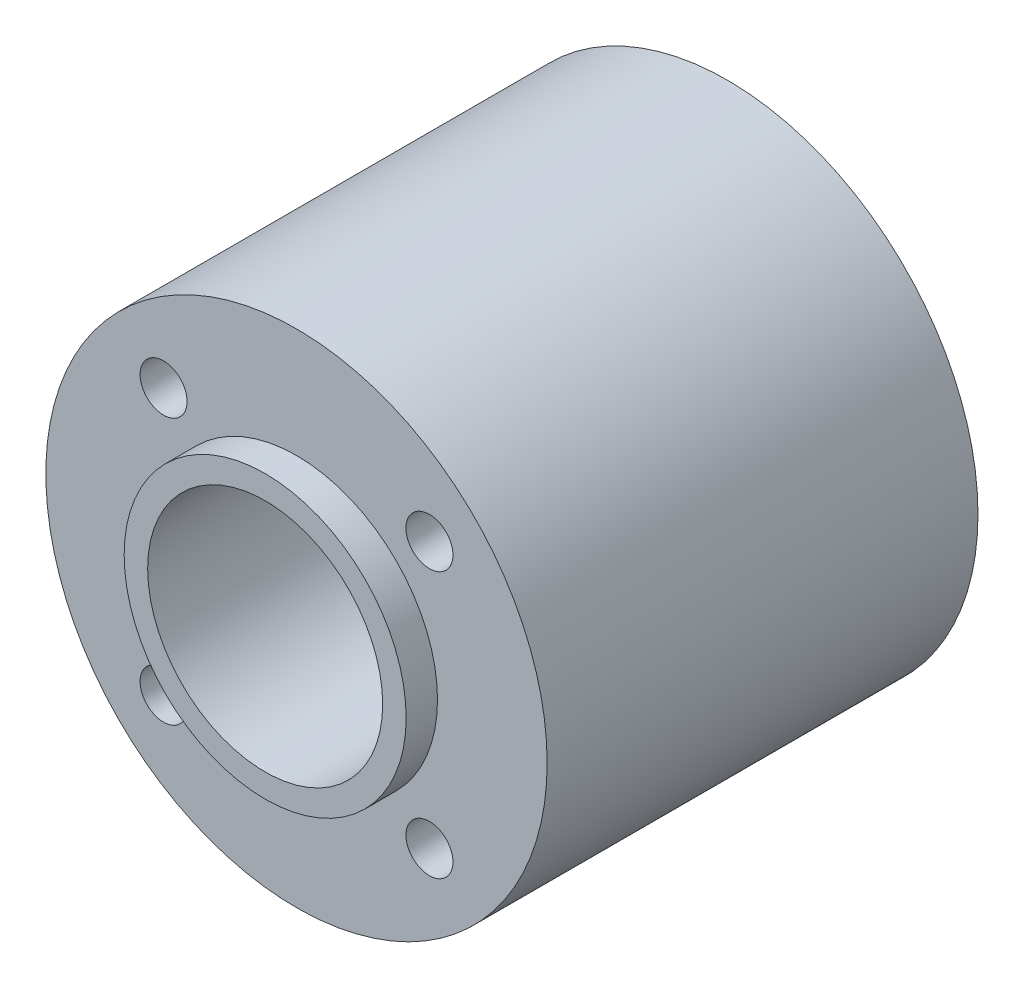
from build123d import *

# Parameters (mm, degrees)
SKETCH1_R           = 16
SKETCH1_R_2         = 1.5
SKETCH1_R_3         = 9
SKETCH1_R_4         = 7.5
BOSS_EXTRUDE1_DEPTH = 13.75
SKETCH2_R           = 1.5
CUT_EXTRUDE1_DEPTH  = 36.612497806
CIRPATTERN1_COUNT   = 4
SKETCH3_R           = 9
SKETCH3_R_2         = 7.5
BOSS_EXTRUDE2_DEPTH = 2


with BuildPart() as part:
    # Sketch1 → Boss-Extrude1 (new, symmetric)
    # profile 1 of 3: a face of its own
    with BuildSketch(Plane.XY):
        Circle(SKETCH1_R)
        with Locations((-8.485281374, 8.485281374)):
            Circle(SKETCH1_R_2, mode=Mode.SUBTRACT)
        Circle(SKETCH1_R_3, mode=Mode.SUBTRACT)
    # profile 2 of 3: a face of its own
    with BuildSketch(Plane.XY):
        with Locations((-8.485281374, 8.485281374)):
            Circle(SKETCH1_R_2)
    # profile 3 of 3: a face of its own
    with BuildSketch(Plane.XY):
        Circle(SKETCH1_R_3)
        Circle(SKETCH1_R_4, mode=Mode.SUBTRACT)
    extrude(amount=BOSS_EXTRUDE1_DEPTH, both=True)

    # Sketch2 → Cut-Extrude1 (cut, symmetric)
    with BuildSketch(Plane.XY.offset(13.75)):
        with Locations((-8.485281374, 8.485281374)):
            Circle(SKETCH2_R)
    cut_extrude1 = extrude(amount=CUT_EXTRUDE1_DEPTH, both=True, mode=Mode.SUBTRACT)

    # CirPattern1: Cut-Extrude1 ×4 about axis
    cirpattern1_axis = Axis((0, 0, 0), (0, 0, 1))
    for i in range(1, CIRPATTERN1_COUNT):
        add(cut_extrude1.rotate(cirpattern1_axis, i * 360 / CIRPATTERN1_COUNT), mode=Mode.SUBTRACT)

    # Sketch3 → Boss-Extrude2 (add)
    with BuildSketch(Plane.XY.offset(13.75)):
        Circle(SKETCH3_R)
        Circle(SKETCH3_R_2, mode=Mode.SUBTRACT)
    boss_extrude2 = extrude(amount=BOSS_EXTRUDE2_DEPTH)

    # Mirror1: Boss-Extrude2 across plane
    add(boss_extrude2.mirror(Plane.XY))


solid = part.part
